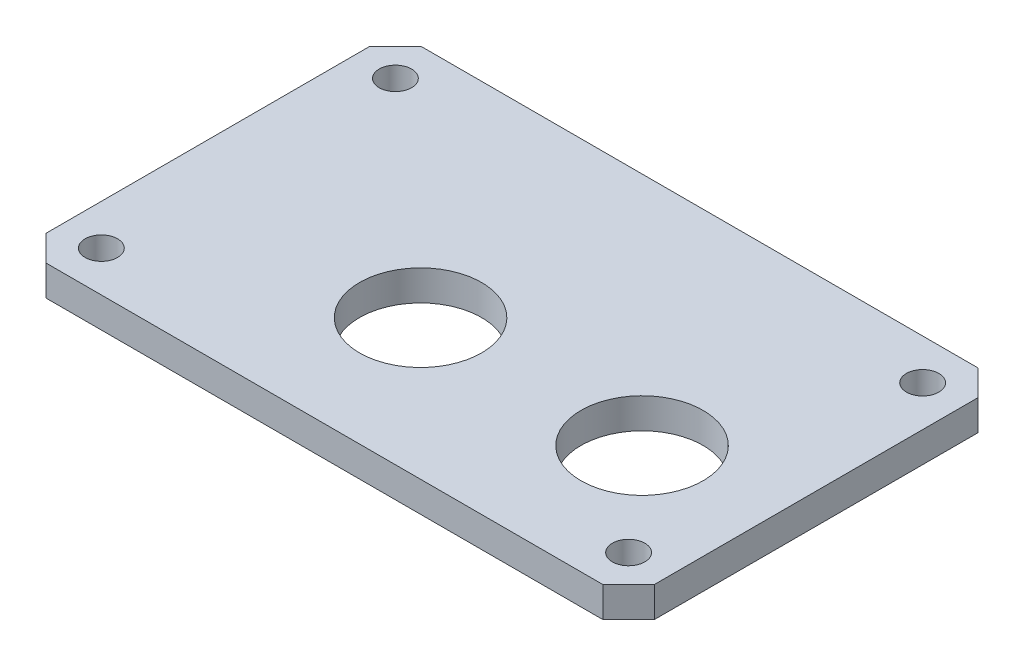
from build123d import *

# Parameters (mm, degrees)
SKETCH1_W           = 60
SKETCH1_H           = 37
BOSS_EXTRUDE1_DEPTH = 2.9972
SKETCH2_R           = 1.6
CUT_EXTRUDE1_DEPTH  = 36.372774952
SKETCH3_R           = 6.0198
CUT_EXTRUDE2_DEPTH  = 36.372774952
CHAMFER1_SIZE       = 2.54


with BuildPart() as part:
    # Sketch1 → Boss-Extrude1 (new body)
    with BuildSketch(Plane(origin=(0, 0, 0), x_dir=(1, 0, 0), z_dir=(0, 1, 0))):
        Rectangle(SKETCH1_W, SKETCH1_H)
    extrude(amount=BOSS_EXTRUDE1_DEPTH)

    # Sketch2 → Cut-Extrude1 (cut, through all)
    with BuildSketch(Plane(origin=(0, 2.9972, 0), x_dir=(1, 0, 0), z_dir=(0, 1, 0))):
        with Locations(Location((-26, 14.5, 0), (0, 0, 270))):
            Circle(SKETCH2_R)
        with Locations(Location((-26, -14.5, 0), (0, 0, 270))):
            Circle(SKETCH2_R)
        with Locations(Location((26, -14.5, 0), (0, 0, 270))):
            Circle(SKETCH2_R)
        with Locations(Location((26, 14.5, 0), (0, 0, 270))):
            Circle(SKETCH2_R)
    extrude(amount=-CUT_EXTRUDE1_DEPTH, mode=Mode.SUBTRACT)

    # Sketch3 → Cut-Extrude2 (cut, through all)
    with BuildSketch(Plane(origin=(0, 2.9972, 0), x_dir=(1, 0, 0), z_dir=(0, 1, 0))):
        with Locations(Location((-4.318, -4.699, 0), (0, 0, 270))):
            Circle(SKETCH3_R)
        with Locations(Location((17.526, -4.699, 0), (0, 0, 270))):
            Circle(SKETCH3_R)
    extrude(amount=-CUT_EXTRUDE2_DEPTH, mode=Mode.SUBTRACT)

    # Chamfer1
    chamfer1_edges = [part.edges().sort_by_distance(p)[0] for p in [
        (30, 1.4986, 18.5),
        (-30, 1.4986, 18.5),
        (-30, 1.4986, -18.5),
        (30, 1.4986, -18.5),
    ]]
    chamfer(chamfer1_edges, length=CHAMFER1_SIZE)


solid = part.part
